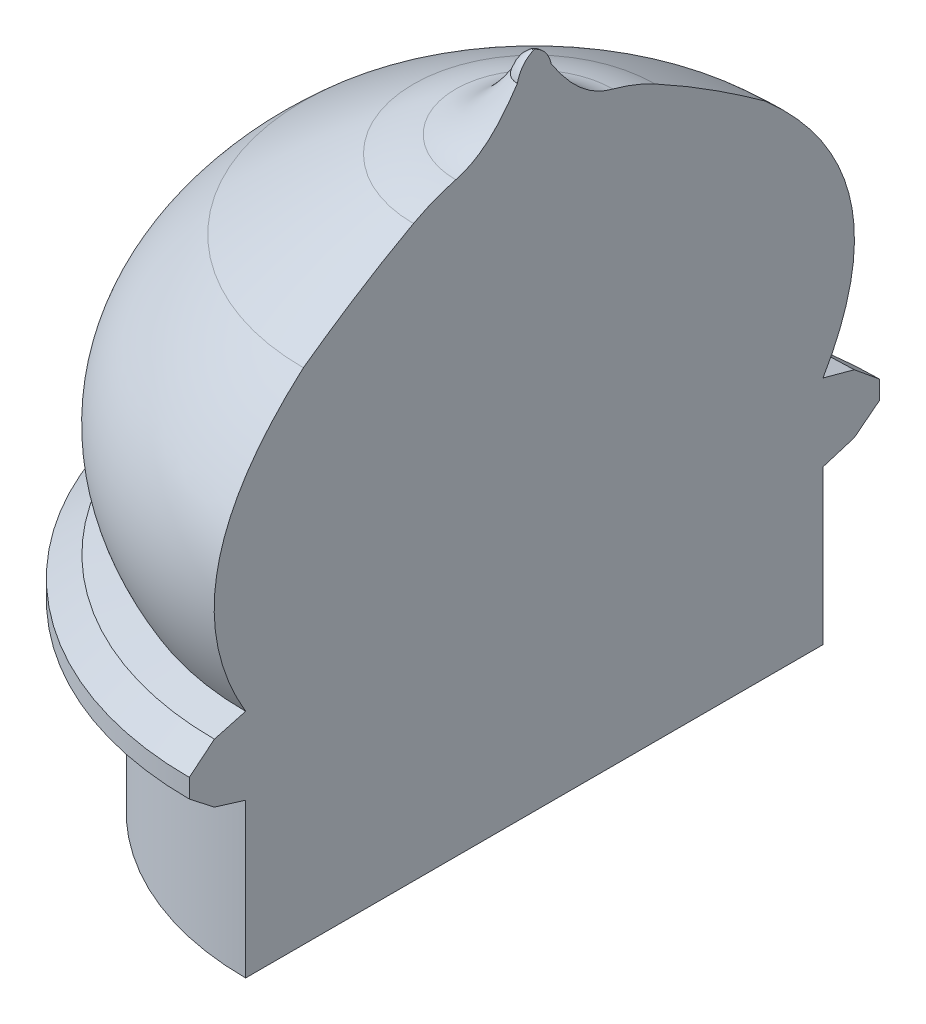
from build123d import *

# Parameters (mm, degrees)
REVOLVE1_ANGLE = 180


with BuildPart() as part:
    # Sketch4 → Revolve1 (revolve)
    with BuildSketch(Plane(origin=(0, 0, 0), x_dir=(0, 0, -1), z_dir=(1, 0, 0))):
        with BuildLine():
            Line((0, 43.554228777), (0, 0))
            Line((0, 0), (-19.05, 0))
            Line((-19.05, 0), (-19.05, 10.16))
            Line((-19.05, 10.16), (-21.1117011, 10.795))
            Line((-21.1117011, 10.795), (-22.767765969, 12.084590197))
            Line((-22.767765969, 12.084590197), (-22.767765969, 13.323327865))
            Line((-22.767765969, 13.323327865), (-21.1117011, 14.680643181))
            Line((-21.1117011, 14.680643181), (-19.05, 15.24))
            add(Edge.make_bspline(
                [(-19.05, 15.24), (-24.619555557, 24.713120096), (-15.24, 32.969594186)],
                knots=[0, 0, 0, 1, 1, 1], degree=2))
            add(Edge.make_bspline(
                [(-15.24, 32.969594186), (-13.159056011, 34.466761199), (-10.754138268, 36.044746883), (-8.242416232, 37.433272674), (-7.973778325, 37.578839171)],
                knots=[0, 0, 0, 0, 0.730138174, 0.817134496, 0.817134496, 0.817134496, 0.817134496], degree=3))
            ThreePointArc((-7.973778325, 37.578839171), (-6.612881823, 38.215201507), (-5.186361227, 38.686407728))
            add(Edge.make_bspline(
                [(-5.186361227, 38.686407728), (-3.351057226, 39.150966228), (-2.104803263, 40.656792731), (-1.118621699, 42.156292635)],
                knots=[0, 0, 0, 0, 1, 1, 1, 1], degree=3))
            add(Edge.make_bspline(
                [(-1.118621699, 42.156292635), (-0.886078473, 43.158491049), (0, 43.554228777)],
                knots=[0, 0, 0, 1, 1, 1], degree=2))
        make_face()
    revolve(axis=Axis((0, 43.554228777, 0), (0, -1, 0)), revolution_arc=REVOLVE1_ANGLE)


solid = part.part
